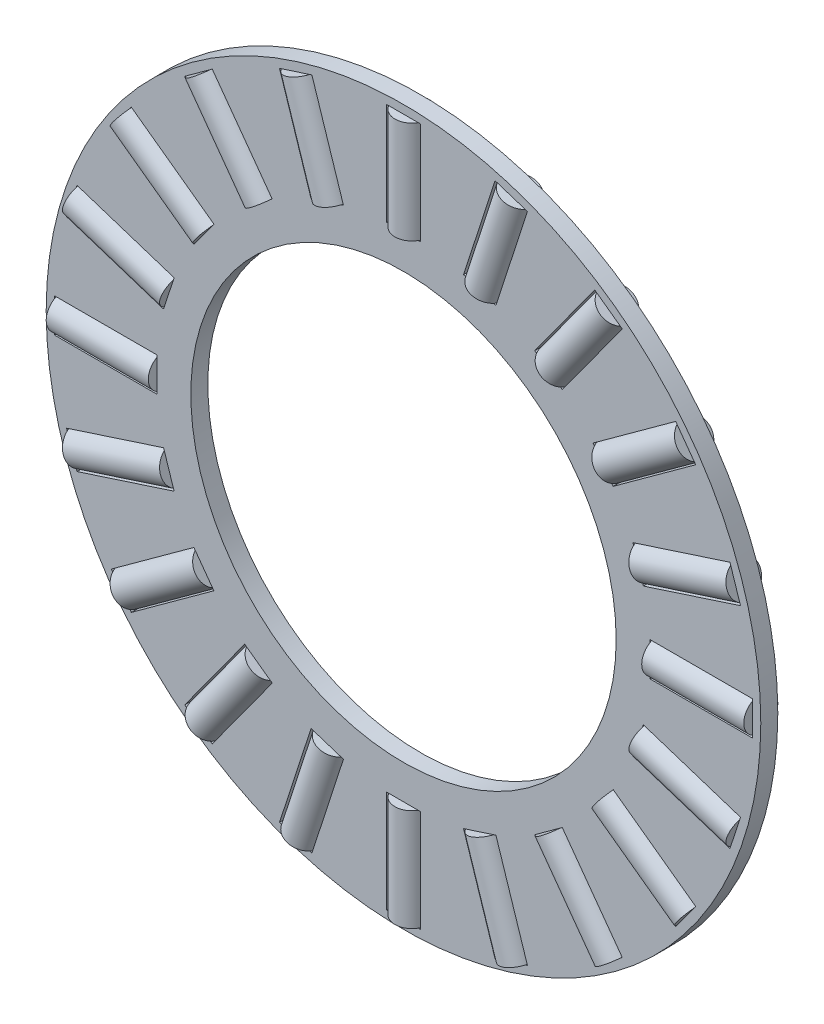
from build123d import *

# Parameters (mm, degrees)
SKETCH_1_R               = 21
SKETCH_1_R_2             = 12.5
EXTRUDE_1_DEPTH          = 1
CUT_EXTRUDE_1_DEPTH      = 30.702693481
PATTERN_CIRCULAR_1_COUNT = 20
SKETCH_5_R               = 1
EXTRUDE_5_DEPTH          = 6
PATTERN_CIRCULAR_8_COUNT = 20


with BuildPart() as part:
    # 草图1 → 凸台-拉伸1 (new body)
    with BuildSketch(Plane.XY):
        Circle(SKETCH_1_R)
        Circle(SKETCH_1_R_2, mode=Mode.SUBTRACT)
    extrude(amount=EXTRUDE_1_DEPTH)

    # 草图3 → 切除-拉伸1 (cut, symmetric)
    with BuildSketch(Plane.XY.offset(0.5)):
        Polygon((0, 14.5), (1, 14.5), (1, 20.5), (-1, 20.5), (-1, 14.5), align=None)
    cut_extrude_1 = extrude(amount=CUT_EXTRUDE_1_DEPTH, both=True, mode=Mode.SUBTRACT)

    # 阵列(圆周)1: 切除-拉伸1 ×20 about axis
    pattern_circular_1_axis = Axis((0, 0, 0), (0, 0, 1))
    for i in range(1, PATTERN_CIRCULAR_1_COUNT):
        add(cut_extrude_1.rotate(pattern_circular_1_axis, i * 360 / PATTERN_CIRCULAR_1_COUNT), mode=Mode.SUBTRACT)


with BuildPart() as body_2:
    # 草图5 → 凸台-拉伸5 (new body)
    with BuildSketch(Plane(origin=(0, 20.5, 0), x_dir=(1, 0, 0), z_dir=(0, 1, 0))):
        with Locations(Location((0, -0.5, 0), (0, 0, 270))):
            Circle(SKETCH_5_R)
    extrude(amount=-EXTRUDE_5_DEPTH)


with BuildPart() as pattern_circular_8_1:
    # 阵列(圆周)8: pattern copy
    add(body_2.part.rotate(Axis((0, 0, 0), (0, 0, 1)), 1 * 360 / PATTERN_CIRCULAR_8_COUNT))


with BuildPart() as pattern_circular_8_2:
    # 阵列(圆周)8: pattern copy
    add(body_2.part.rotate(Axis((0, 0, 0), (0, 0, 1)), 2 * 360 / PATTERN_CIRCULAR_8_COUNT))


with BuildPart() as pattern_circular_8_3:
    # 阵列(圆周)8: pattern copy
    add(body_2.part.rotate(Axis((0, 0, 0), (0, 0, 1)), 3 * 360 / PATTERN_CIRCULAR_8_COUNT))


with BuildPart() as pattern_circular_8_4:
    # 阵列(圆周)8: pattern copy
    add(body_2.part.rotate(Axis((0, 0, 0), (0, 0, 1)), 4 * 360 / PATTERN_CIRCULAR_8_COUNT))


with BuildPart() as pattern_circular_8_5:
    # 阵列(圆周)8: pattern copy
    add(body_2.part.rotate(Axis((0, 0, 0), (0, 0, 1)), 5 * 360 / PATTERN_CIRCULAR_8_COUNT))


with BuildPart() as pattern_circular_8_6:
    # 阵列(圆周)8: pattern copy
    add(body_2.part.rotate(Axis((0, 0, 0), (0, 0, 1)), 6 * 360 / PATTERN_CIRCULAR_8_COUNT))


with BuildPart() as pattern_circular_8_7:
    # 阵列(圆周)8: pattern copy
    add(body_2.part.rotate(Axis((0, 0, 0), (0, 0, 1)), 7 * 360 / PATTERN_CIRCULAR_8_COUNT))


with BuildPart() as pattern_circular_8_8:
    # 阵列(圆周)8: pattern copy
    add(body_2.part.rotate(Axis((0, 0, 0), (0, 0, 1)), 8 * 360 / PATTERN_CIRCULAR_8_COUNT))


with BuildPart() as pattern_circular_8_9:
    # 阵列(圆周)8: pattern copy
    add(body_2.part.rotate(Axis((0, 0, 0), (0, 0, 1)), 9 * 360 / PATTERN_CIRCULAR_8_COUNT))


with BuildPart() as pattern_circular_8_10:
    # 阵列(圆周)8: pattern copy
    add(body_2.part.rotate(Axis((0, 0, 0), (0, 0, 1)), 10 * 360 / PATTERN_CIRCULAR_8_COUNT))


with BuildPart() as pattern_circular_8_11:
    # 阵列(圆周)8: pattern copy
    add(body_2.part.rotate(Axis((0, 0, 0), (0, 0, 1)), 11 * 360 / PATTERN_CIRCULAR_8_COUNT))


with BuildPart() as pattern_circular_8_12:
    # 阵列(圆周)8: pattern copy
    add(body_2.part.rotate(Axis((0, 0, 0), (0, 0, 1)), 12 * 360 / PATTERN_CIRCULAR_8_COUNT))


with BuildPart() as pattern_circular_8_13:
    # 阵列(圆周)8: pattern copy
    add(body_2.part.rotate(Axis((0, 0, 0), (0, 0, 1)), 13 * 360 / PATTERN_CIRCULAR_8_COUNT))


with BuildPart() as pattern_circular_8_14:
    # 阵列(圆周)8: pattern copy
    add(body_2.part.rotate(Axis((0, 0, 0), (0, 0, 1)), 14 * 360 / PATTERN_CIRCULAR_8_COUNT))


with BuildPart() as pattern_circular_8_15:
    # 阵列(圆周)8: pattern copy
    add(body_2.part.rotate(Axis((0, 0, 0), (0, 0, 1)), 15 * 360 / PATTERN_CIRCULAR_8_COUNT))


with BuildPart() as pattern_circular_8_16:
    # 阵列(圆周)8: pattern copy
    add(body_2.part.rotate(Axis((0, 0, 0), (0, 0, 1)), 16 * 360 / PATTERN_CIRCULAR_8_COUNT))


with BuildPart() as pattern_circular_8_17:
    # 阵列(圆周)8: pattern copy
    add(body_2.part.rotate(Axis((0, 0, 0), (0, 0, 1)), 17 * 360 / PATTERN_CIRCULAR_8_COUNT))


with BuildPart() as pattern_circular_8_18:
    # 阵列(圆周)8: pattern copy
    add(body_2.part.rotate(Axis((0, 0, 0), (0, 0, 1)), 18 * 360 / PATTERN_CIRCULAR_8_COUNT))


with BuildPart() as pattern_circular_8_19:
    # 阵列(圆周)8: pattern copy
    add(body_2.part.rotate(Axis((0, 0, 0), (0, 0, 1)), 19 * 360 / PATTERN_CIRCULAR_8_COUNT))


solid = Compound([part.part, body_2.part, pattern_circular_8_1.part, pattern_circular_8_2.part, pattern_circular_8_3.part, pattern_circular_8_4.part, pattern_circular_8_5.part, pattern_circular_8_6.part, pattern_circular_8_7.part, pattern_circular_8_8.part, pattern_circular_8_9.part, pattern_circular_8_10.part, pattern_circular_8_11.part, pattern_circular_8_12.part, pattern_circular_8_13.part, pattern_circular_8_14.part, pattern_circular_8_15.part, pattern_circular_8_16.part, pattern_circular_8_17.part, pattern_circular_8_18.part, pattern_circular_8_19.part])
